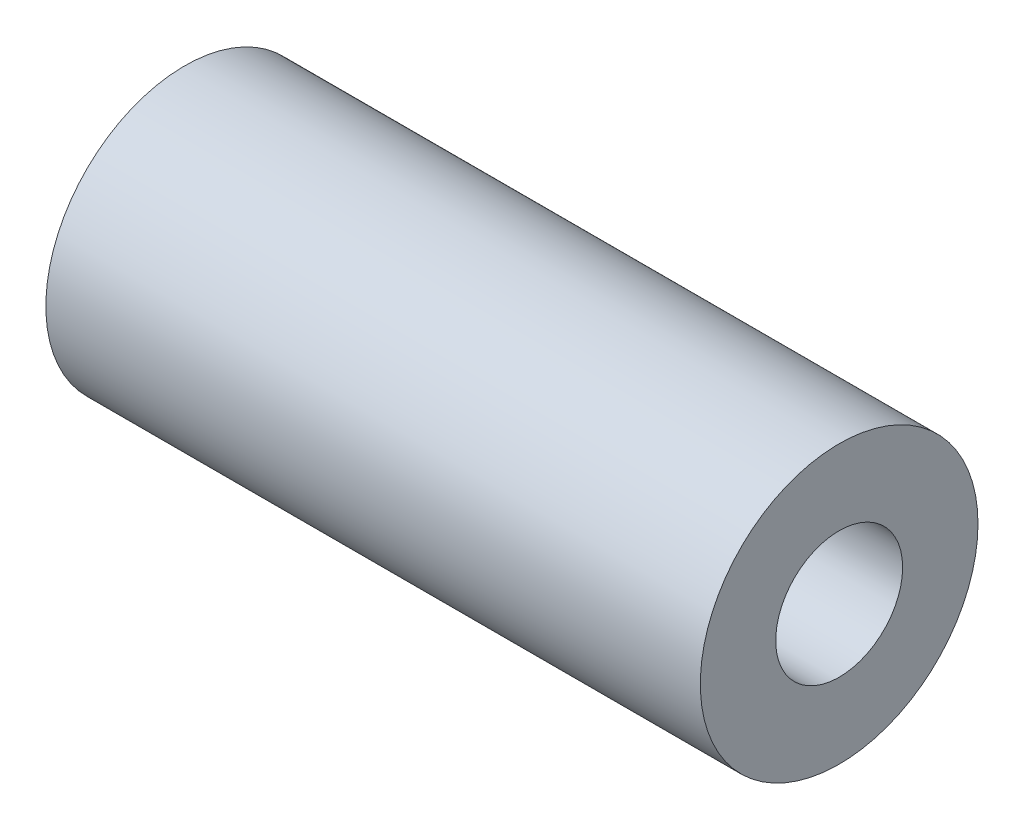
from build123d import *

# Parameters (mm, degrees)
SKETCH1_R           = 3.5
SKETCH1_R_2         = 1.6
BOSS_EXTRUDE1_DEPTH = 16.5


with BuildPart() as part:
    # Sketch1 → Boss-Extrude1 (new body)
    with BuildSketch(Plane(origin=(0, 0, 0), x_dir=(0, 0, -1), z_dir=(1, 0, 0))):
        Circle(SKETCH1_R)
        Circle(SKETCH1_R_2, mode=Mode.SUBTRACT)
    extrude(amount=BOSS_EXTRUDE1_DEPTH)


solid = part.part
